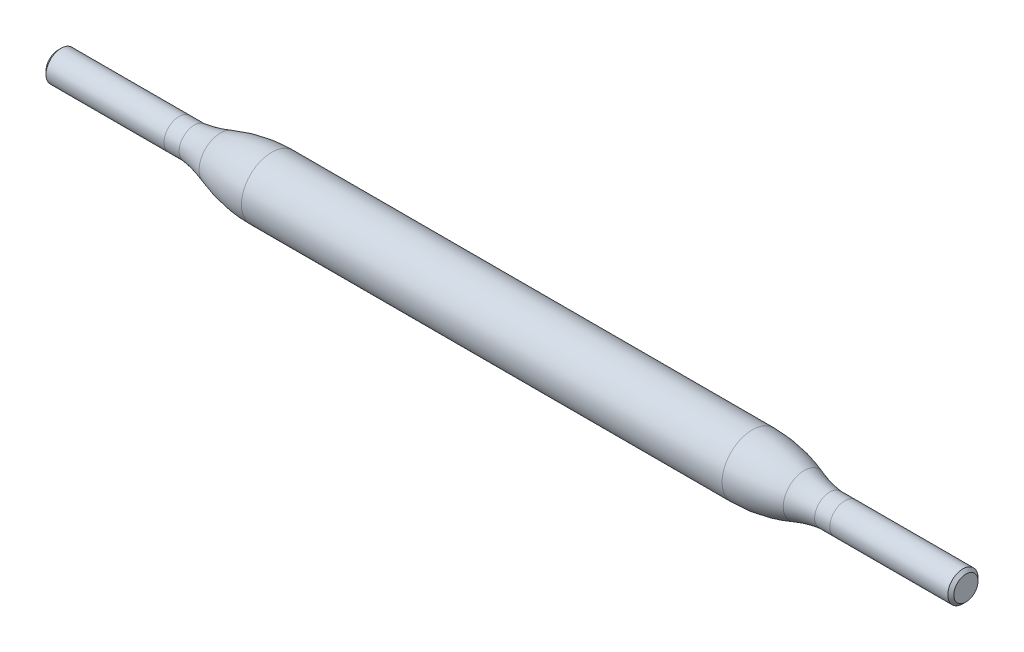
from build123d import *

# Parameters (mm, degrees)
CHAMFER1_SIZE = 0.2


with BuildPart() as part:
    # Sketch1 → Revolve1 (revolve)
    with BuildSketch(Plane.XY, mode=Mode.PRIVATE) as revolve1_sk:
        with BuildLine():
            Line((-30, 0), (30, 0))
            Line((30, 0), (30, 1))
            Line((30, 1), (21, 1))
            ThreePointArc((21, 1), (20.146606905, 1.145068441), (19.317048796, 1.392369816))
            ThreePointArc((19.317048796, 1.392369816), (17.627383867, 1.846920792), (15.884354631, 2))
            Line((15.884354631, 2), (-15.884354631, 2))
            ThreePointArc((-15.884354631, 2), (-17.60385956, 1.851055923), (-19.272142474, 1.40866056))
            ThreePointArc((-19.272142474, 1.40866056), (-20.124476001, 1.155304466), (-21, 1))
            Line((-21, 1), (-30, 1))
            Line((-30, 1), (-30, 0))
        make_face()
    revolve(revolve1_sk.sketch.rotate(Axis((-30, 0, 0), (1, 0, 0)), 180), axis=Axis((-30, 0, 0), (1, 0, 0)))

    # Chamfer1
    chamfer1_edges = [part.edges().sort_by_distance(p)[0] for p in [
        (30, 1, 0),
        (-30, 1, 0),
    ]]
    chamfer(chamfer1_edges, length=CHAMFER1_SIZE)


solid = part.part
